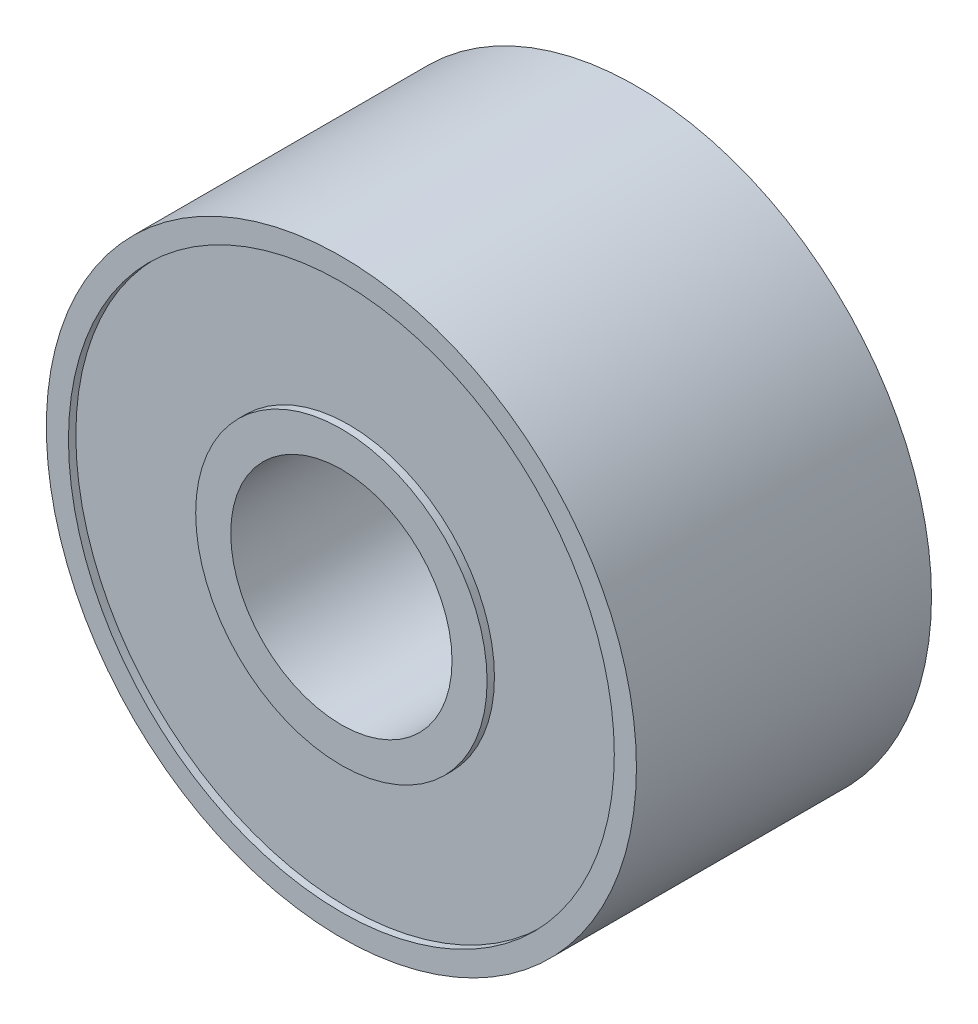
from build123d import *

# Parameters (mm, degrees)
SKETCH1_R           = 4
SKETCH1_R_2         = 1.5
BOSS_EXTRUDE1_DEPTH = 4
SKETCH2_R           = 3.7
SKETCH2_R_2         = 1.975178003
CUT_EXTRUDE1_DEPTH  = 0.1
CUT_EXTRUDE2_START  = -0.1
SKETCH3_R           = 3.7
SKETCH3_R_2         = 1.975178003
CUT_EXTRUDE2_DEPTH  = 0.1


with BuildPart() as part:
    # Sketch1 → Boss-Extrude1 (new body)
    with BuildSketch(Plane.XY):
        Circle(SKETCH1_R)
        Circle(SKETCH1_R_2, mode=Mode.SUBTRACT)
    extrude(amount=BOSS_EXTRUDE1_DEPTH)

    # Sketch2 → Cut-Extrude1 (cut)
    with BuildSketch(Plane.XY.offset(4)):
        Circle(SKETCH2_R)
        Circle(SKETCH2_R_2, mode=Mode.SUBTRACT)
    extrude(amount=-CUT_EXTRUDE1_DEPTH, mode=Mode.SUBTRACT)

    # Sketch3 → Cut-Extrude2 (cut)
    with BuildSketch(Plane(origin=(0, 0, 0), x_dir=(-1, 0, 0), z_dir=(0, 0, -1)).offset(CUT_EXTRUDE2_START)):
        with Locations(Location((0, 0, 0), (0, 0, 180))):
            Circle(SKETCH3_R)
        with Locations(Location((0, 0, 0), (0, 0, 180))):
            Circle(SKETCH3_R_2, mode=Mode.SUBTRACT)
    extrude(amount=CUT_EXTRUDE2_DEPTH, mode=Mode.SUBTRACT)


solid = part.part
